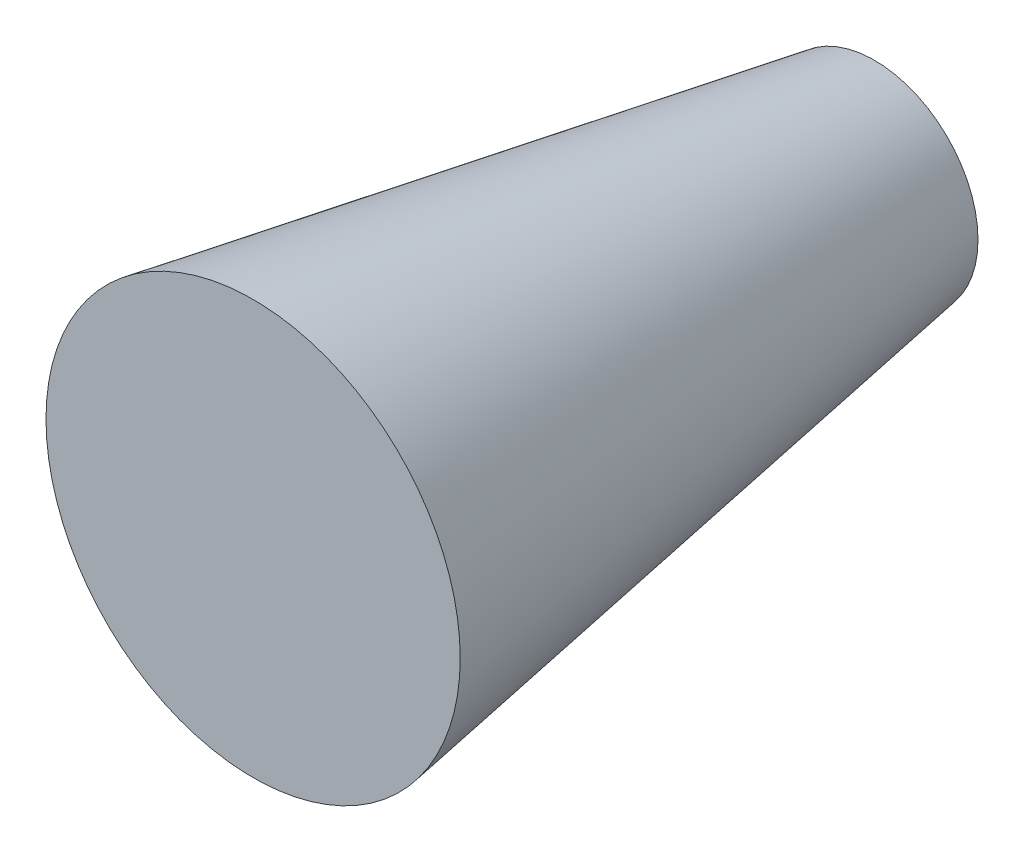
from build123d import *

# Parameters (mm, degrees)
PROFILE1_R = 5
PROFILE2_R = 10


with BuildPart() as part:
    # Profile1 → loft_circle10_20 section 0
    with BuildSketch(Plane.XY):
        Circle(PROFILE1_R)
    # Profile2 → loft_circle10_20 section 1
    with BuildSketch(Plane.XY.offset(30)):
        Circle(PROFILE2_R)
    loft()


solid = part.part
